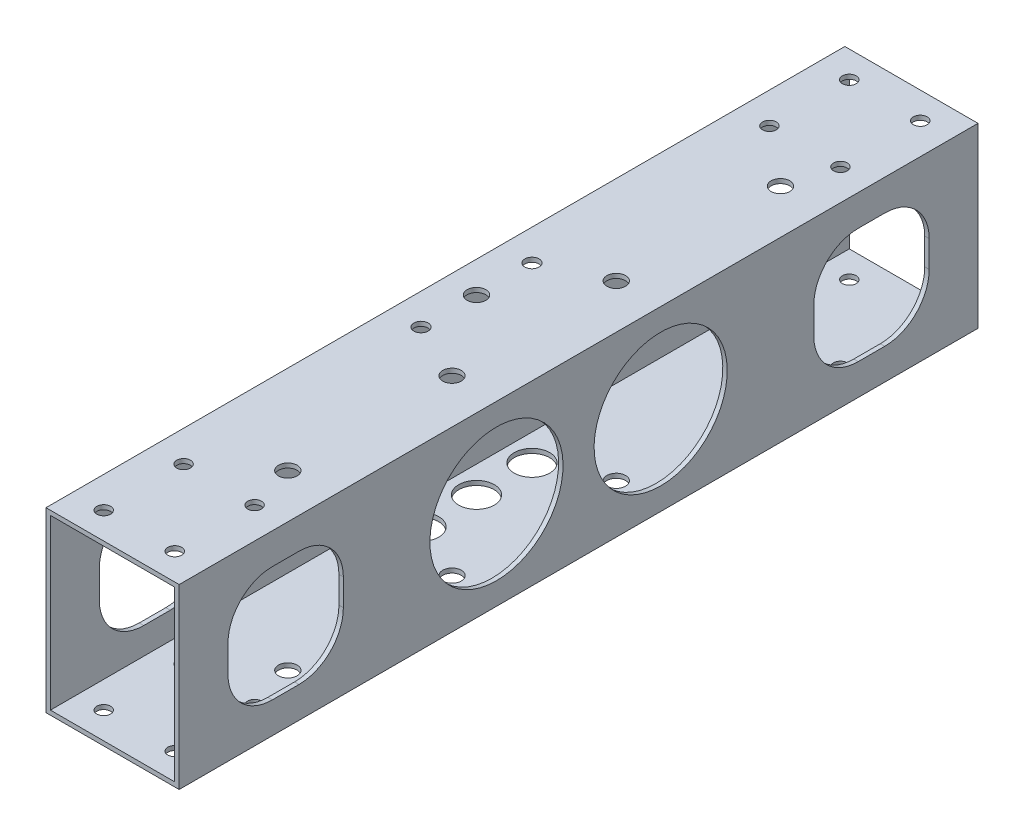
from build123d import *

# Parameters (mm, degrees)
SKETCH_1_W          = 30
SKETCH_1_H          = 40
SKETCH_1_W_2        = 28
SKETCH_1_H_2        = 38
EXTRUDE_1_DEPTH     = 90
SKETCH_2_R          = 1.55
CUT_EXTRUDE_1_DEPTH = 40
SKETCH_3_R          = 2.1
CUT_EXTRUDE_2_DEPTH = 10
SKETCH_4_R          = 15
CUT_EXTRUDE_3_DEPTH = 40
SKETCH_5_R          = 2.1
SKETCH_5_R_2        = 1.6
CUT_EXTRUDE_4_DEPTH = 10
SKETCH_6_R          = 4
CUT_EXTRUDE_5_DEPTH = 10
CUT_EXTRUDE_START   = -50
SKETCH_7_R          = 2.1
CUT_EXTRUDE_6_DEPTH = 50


with BuildPart() as part:
    # 草图1 → 凸台-拉伸1 (new, symmetric)
    with BuildSketch(Plane.XY):
        Rectangle(SKETCH_1_W, SKETCH_1_H)
        Rectangle(SKETCH_1_W_2, SKETCH_1_H_2, mode=Mode.SUBTRACT)
    extrude(amount=EXTRUDE_1_DEPTH, both=True)

    # 草图2 → 切除-拉伸1 (cut, symmetric)
    with BuildSketch(Plane(origin=(0, 20, 0), x_dir=(1, 0, 0), z_dir=(0, 1, 0))):
        with Locations(Location((-8, -84, 0), (0, 0, 270))):
            Circle(SKETCH_2_R)
        with Locations(Location((8, -84, 0), (0, 0, 270))):
            Circle(SKETCH_2_R)
        with Locations(Location((8, -66, 0), (0, 0, 270))):
            Circle(SKETCH_2_R)
        with Locations(Location((-8, -66, 0), (0, 0, 270))):
            Circle(SKETCH_2_R)
        with Locations(Location((-8, 66, 0), (0, 0, 270))):
            Circle(SKETCH_2_R)
        with Locations(Location((8, 66, 0), (0, 0, 270))):
            Circle(SKETCH_2_R)
        with Locations(Location((8, 84, 0), (0, 0, 270))):
            Circle(SKETCH_2_R)
        with Locations(Location((-8, 84, 0), (0, 0, 270))):
            Circle(SKETCH_2_R)
    extrude(amount=CUT_EXTRUDE_1_DEPTH, both=True, mode=Mode.SUBTRACT)

    # 草图3 → 切除-拉伸2 (cut)
    with BuildSketch(Plane(origin=(0, -19, 0), x_dir=(1, 0, 0), z_dir=(0, 1, 0))):
        with Locations(Location((5, -55.51, 0), (0, 0, 270))):
            Circle(SKETCH_3_R)
        with Locations(Location((5, -18.51, 0), (0, 0, 270))):
            Circle(SKETCH_3_R)
        with Locations(Location((5, 18.49, 0), (0, 0, 270))):
            Circle(SKETCH_3_R)
        with Locations(Location((5, 55.49, 0), (0, 0, 270))):
            Circle(SKETCH_3_R)
    extrude(amount=-CUT_EXTRUDE_2_DEPTH, mode=Mode.SUBTRACT)

    # 草图4 → 切除-拉伸3 (cut)
    with BuildSketch(Plane.ZY.offset(15)):
        with Locations(Location((18.5, 0, 0), (0, 0, 270))):
            Circle(SKETCH_4_R)
        with Locations(Location((-18.5, 0, 0), (0, 0, 180))):
            Circle(SKETCH_4_R)
        with BuildLine():
            Line((63, 13), (69, 13))
            ThreePointArc((69, 13), (76.071067812, 10.071067812), (79, 3))
            Line((79, 3), (79, -3))
            ThreePointArc((79, -3), (76.071067812, -10.071067812), (69, -13))
            Line((69, -13), (63, -13))
            ThreePointArc((63, -13), (55.928932188, -10.071067812), (53, -3))
            Line((53, -3), (53, 3))
            ThreePointArc((53, 3), (55.928932188, 10.071067812), (63, 13))
        make_face()
        with BuildLine():
            Line((-63, -13), (-69, -13))
            ThreePointArc((-69, -13), (-76.071067812, -10.071067812), (-79, -3))
            Line((-79, -3), (-79, 3))
            ThreePointArc((-79, 3), (-76.071067812, 10.071067812), (-69, 13))
            Line((-69, 13), (-63, 13))
            ThreePointArc((-63, 13), (-55.928932188, 10.071067812), (-53, 3))
            Line((-53, 3), (-53, -3))
            ThreePointArc((-53, -3), (-55.928932188, -10.071067812), (-63, -13))
        make_face()
    extrude(amount=-CUT_EXTRUDE_3_DEPTH, mode=Mode.SUBTRACT)

    # 草图5 → 切除-拉伸4 (cut)
    with BuildSketch(Plane(origin=(0, 20, 0), x_dir=(1, 0, 0), z_dir=(0, 1, 0))):
        with Locations(Location((-8, 0, 0), (0, 0, 270))):
            Circle(SKETCH_5_R)
        with Locations(Location((-8, 12.5, 0), (0, 0, 270))):
            Circle(SKETCH_5_R_2)
        with Locations(Location((-8, -12.5, 0), (0, 0, 270))):
            Circle(SKETCH_5_R_2)
    extrude(amount=-CUT_EXTRUDE_4_DEPTH, mode=Mode.SUBTRACT)

    # 草图6 → 切除-拉伸5 (cut)
    with BuildSketch(Plane(origin=(0, -19, 0), x_dir=(1, 0, 0), z_dir=(0, 1, 0))):
        with Locations(Location((-8, -12.5, 0), (0, 0, 270))):
            Circle(SKETCH_6_R)
        with Locations(Location((-8, 12.5, 0), (0, 0, 270))):
            Circle(SKETCH_6_R)
        with Locations(Location((-8, 0, 0), (0, 0, 270))):
            Circle(SKETCH_6_R)
    extrude(amount=-CUT_EXTRUDE_5_DEPTH, mode=Mode.SUBTRACT)

    # 草图7 → 切除-拉伸6 (cut)
    with BuildSketch(Plane.XZ.offset(20).offset(CUT_EXTRUDE_START)):
        with Locations(Location((5, -55.49, 0), (0, 0, 90))):
            Circle(SKETCH_7_R)
        with Locations(Location((5, -18.49, 0), (0, 0, 90))):
            Circle(SKETCH_7_R)
        with Locations(Location((5, 18.51, 0), (0, 0, 90))):
            Circle(SKETCH_7_R)
        with Locations(Location((5, 55.51, 0), (0, 0, 90))):
            Circle(SKETCH_7_R)
    extrude(amount=CUT_EXTRUDE_6_DEPTH, mode=Mode.SUBTRACT)


solid = part.part
